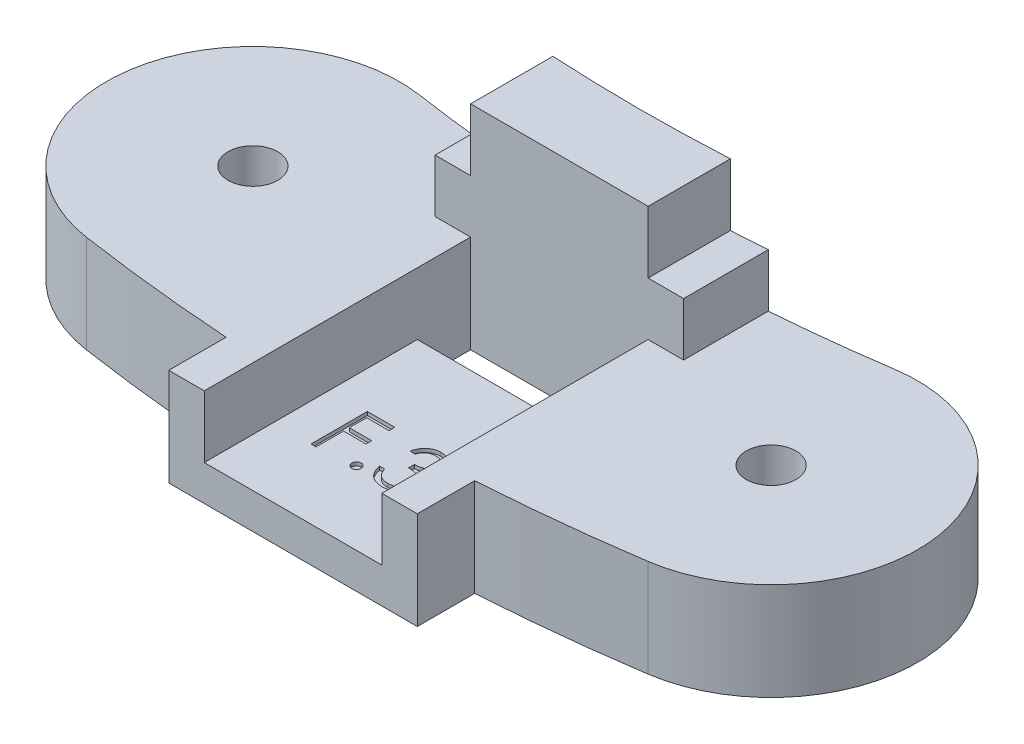
from build123d import *

# Parameters (mm, degrees)
SKETCH2_R                       = 1.4
BOSS_EXTRUDE1_DEPTH             = 14
BOSS_EXTRUDE2_REACH             = 34.049
BOSS_EXTRUDE2_END_RADIUS        = 107
SKETCH3_W                       = 14
SKETCH3_H                       = 14
BOSS_EXTRUDE2_DIRECTION_2_DEPTH = 3
SKETCH19_W                      = 15.846179349
SKETCH19_H                      = 3
CUT_EXTRUDE4_DEPTH              = 22
CUT_EXTRUDE8_DEPTH              = 34.788712692
SKETCH25_W                      = 10
SKETCH25_H                      = 3
CUT_EXTRUDE9_DEPTH              = 2
BOSS_EXTRUDE3_DEPTH             = 3
BOSS_EXTRUDE3_DEPTH_BACK        = 3.5
BOSS_EXTRUDE4_DEPTH             = 3.5
CUT_EXTRUDE10_DEPTH             = 0.2


with BuildPart() as part:
    # Sketch2 → Boss-Extrude1 (new body)
    with BuildSketch(Plane(origin=(0, 0, 0), x_dir=(1, 0, 0), z_dir=(0, 1, 0))):
        with BuildLine():
            ThreePointArc((-13.376751707, 15.494064366), (0, 14.5), (13.376751707, 15.494064366))
            ThreePointArc((13.376751707, 15.494064366), (22.755560222, 8.554111135), (15.815606991, -0.82469738))
            ThreePointArc((15.815606991, -0.82469738), (0, -2), (-15.815606991, -0.82469738))
            ThreePointArc((-15.815606991, -0.82469738), (-22.755560222, 8.554111135), (-13.376751707, 15.494064366))
        make_face()
        with Locations(Location((-14.596179349, 7.334683493, 0), (0, 0, 270))):
            Circle(SKETCH2_R, mode=Mode.SUBTRACT)
        with Locations(Location((14.596179349, 7.334683493, 0), (0, 0, 270))):
            Circle(SKETCH2_R, mode=Mode.SUBTRACT)
    extrude(amount=BOSS_EXTRUDE1_DEPTH)

    # Boss-Extrude2: up to this cylinder (the profile starts outside it)
    boss_extrude2_end = Plane(origin=(0, 7, -105), z_dir=(0, -1, 0)) * Cylinder(BOSS_EXTRUDE2_END_RADIUS, 283.098, mode=Mode.PRIVATE)
    # Sketch3 → Boss-Extrude2 (add, up to the surface)
    with BuildSketch(Plane.XY.offset(2), mode=Mode.PRIVATE) as boss_extrude2_sk1:
        with Locations((0, 7)):
            Rectangle(SKETCH3_W, SKETCH3_H)
    boss_extrude2_tool1 = extrude(boss_extrude2_sk1.sketch, amount=-BOSS_EXTRUDE2_REACH, mode=Mode.PRIVATE) - boss_extrude2_end
    add(boss_extrude2_tool1.solids().sort_by_distance((0, 7, 2))[0])
    add(boss_extrude2_tool1.solids().sort_by_distance((0, 7, 2))[1])

    # Sketch3 → Boss-Extrude2 direction 2 (add)
    with BuildSketch(Plane.XY.offset(2)):
        with Locations((0, 7)):
            Rectangle(SKETCH3_W, SKETCH3_H)
    extrude(amount=BOSS_EXTRUDE2_DIRECTION_2_DEPTH)

    # Sketch19 → Cut-Extrude4 (cut)
    with BuildSketch(Plane.XY.offset(2)):
        with Locations((-14.923089674, 7)):
            Rectangle(SKETCH19_W, SKETCH19_H)
    cut_extrude4 = extrude(amount=-CUT_EXTRUDE4_DEPTH, mode=Mode.SUBTRACT)

    # Mirror2: Cut-Extrude4 across plane
    add(cut_extrude4.mirror(Plane(origin=(0, 0, 0), x_dir=(0, 0, 1), z_dir=(1, 0, 0))), mode=Mode.SUBTRACT)

    # Sketch24 → Cut-Extrude8 (cut, through all)
    with BuildSketch(Plane.XY.offset(5)):
        Polygon((-5, 8.5), (-7, 8.5), (-7, 5.5), (-5, 5.5), (-5, 2), (5, 2), (5, 5.5), (7, 5.5), (7, 8.5), (5, 8.5), (5, 12), (-5, 12), align=None)
    extrude(amount=-CUT_EXTRUDE8_DEPTH, mode=Mode.SUBTRACT)


with BuildPart() as cut_extrude8_kept_piece:
    # of the separate pieces the step leaves, the one the design keeps (cut_extrude8_pieces_kept)
    add(part.part.solids().sort_by_distance((-15.815606991, 0, 0.82469738))[0])

    # Sketch25 → Cut-Extrude9 (cut)
    with BuildSketch(Plane(origin=(0, 2, 0), x_dir=(1, 0, 0), z_dir=(0, 1, 0))):
        with Locations((0, 8.5)):
            Rectangle(SKETCH25_W, SKETCH25_H)
    extrude(amount=-CUT_EXTRUDE9_DEPTH, mode=Mode.SUBTRACT)

    # Sketch26 → Boss-Extrude3 (add, two sides: drawn at the far end of the back side and taken through both)
    with BuildSketch(Plane(origin=(0, 5.5, 0), x_dir=(1, 0, 0), z_dir=(0, 1, 0)).offset(-BOSS_EXTRUDE3_DEPTH_BACK)):
        with BuildLine():
            Line((-7, 14.771124356), (-7, 10))
            Line((-7, 10), (-5, 10))
            Line((-5, 10), (-5, 14.638227109))
            ThreePointArc((-5, 14.638227109), (-6.00036794, 14.699138517), (-7, 14.771124356))
        make_face()
        with BuildLine():
            Line((-5, 14.638227109), (-5, 10))
            Line((-5, 10), (0, 10))
            Line((0, 10), (0, 14.5))
            ThreePointArc((0, 14.5), (-2.500955154, 14.534563377), (-5, 14.638227109))
        make_face()
        with BuildLine():
            Line((0, 14.5), (0, 10))
            Line((0, 10), (5, 10))
            Line((5, 10), (7, 10))
            Line((7, 10), (7, 14.771124356))
            ThreePointArc((7, 14.771124356), (6.00036794, 14.699138517), (5, 14.638227109))
            ThreePointArc((5, 14.638227109), (2.500955154, 14.534563377), (0, 14.5))
        make_face()
    extrude(amount=BOSS_EXTRUDE3_DEPTH + BOSS_EXTRUDE3_DEPTH_BACK)

    # Sketch27 → Boss-Extrude4 (add)
    with BuildSketch(Plane(origin=(0, 8.5, 0), x_dir=(1, 0, 0), z_dir=(0, 1, 0))):
        with BuildLine():
            Line((-5, 14.638227109), (-5, 10))
            Line((-5, 10), (5, 10))
            Line((5, 10), (5, 14.638227109))
            ThreePointArc((5, 14.638227109), (0, 14.5), (-5, 14.638227109))
        make_face()
    extrude(amount=BOSS_EXTRUDE4_DEPTH)

    # Sketch28 → Cut-Extrude10 (cut)
    with BuildSketch(Plane(origin=(0, 2, 0), x_dir=(1, 0, 0), z_dir=(0, 1, 0))):
        Polygon((-2.898336932, 2.085555905), (-1.351542061, 2.085555905), (-1.351542061, 1.759914879), (-2.613401035, 1.759914879), (-2.613401035, 0.782991802), (-1.351542061, 0.782991802), (-1.351542061, 0.457350776), (-2.613401035, 0.457350776), (-2.613401035, -1.089444095), (-2.898336932, -1.089444095), align=None)
        with BuildLine():
            add(Edge.make_bspline(
                [(-0.557792061, -0.600982557), (-0.540111654, -0.60203318), (-0.505451283, -0.604092802), (-0.455341503, -0.618223071), (-0.409989204, -0.643313427), (-0.369592097, -0.676753233), (-0.336294079, -0.717298585), (-0.310309559, -0.762289159), (-0.29630238, -0.812818461), (-0.29425776, -0.847679666), (-0.293208727, -0.86556589)],
                knots=[0, 0, 0, 0, 1.020151414, 1.999887582, 2.974338812, 3.990962822, 5.007586832, 5.987933904, 6.967670073, 8, 8, 8, 8], degree=3))
            add(Edge.make_bspline(
                [(-0.293208727, -0.86556589), (-0.294293308, -0.883022339), (-0.296432085, -0.917446201), (-0.310277451, -0.967594385), (-0.336492111, -1.012613077), (-0.369362426, -1.053708588), (-0.409999191, -1.087219234), (-0.455448723, -1.112096126), (-0.50533365, -1.127238136), (-0.540092029, -1.129166991), (-0.557792061, -1.130149224)],
                knots=[0, 0, 0, 0, 1.009421747, 1.99056486, 2.972319754, 3.999869655, 5.017953583, 5.993804169, 6.978383603, 8, 8, 8, 8], degree=3))
            add(Edge.make_bspline(
                [(-0.557792061, -1.130149224), (-0.575504847, -1.129202532), (-0.610084844, -1.127354342), (-0.659783568, -1.111785224), (-0.705509889, -1.087452514), (-0.746138742, -1.053646103), (-0.779284355, -1.012824545), (-0.804344524, -0.967284344), (-0.819394159, -0.917589754), (-0.82137343, -0.883050614), (-0.822375394, -0.86556589)],
                knots=[0, 0, 0, 0, 1.022052826, 1.995314843, 2.982371812, 4.00089066, 5.028879526, 6.005146991, 6.990147033, 8, 8, 8, 8], degree=3))
            add(Edge.make_bspline(
                [(-0.822375394, -0.86556589), (-0.821411918, -0.847650382), (-0.81953085, -0.81267255), (-0.80431293, -0.762599073), (-0.779478795, -0.717089132), (-0.745909615, -0.676815092), (-0.705519718, -0.643080896), (-0.659893875, -0.618529262), (-0.609965149, -0.603978316), (-0.575484705, -0.601998462), (-0.557792061, -0.600982557)],
                knots=[0, 0, 0, 0, 1.032775665, 2.016367738, 2.991239715, 4.008302682, 5.025365648, 6.011011707, 6.979408107, 8, 8, 8, 8], degree=3))
        make_face()
        with BuildLine():
            Line((0.520893837, 1.352863597), (0.235957939, 1.352863597))
            add(Edge.make_bspline(
                [(0.235957939, 1.352863597), (0.243677317, 1.384824493), (0.25876807, 1.447305431), (0.290243726, 1.536574875), (0.324533051, 1.621051212), (0.365707453, 1.69915265), (0.410618965, 1.772448798), (0.462074577, 1.839277218), (0.517700325, 1.901337551), (0.579227244, 1.956413131), (0.643751101, 2.006285785), (0.712181077, 2.048808158), (0.783140417, 2.085387926), (0.857120759, 2.115523422), (0.934342357, 2.138225147), (1.014107087, 2.154695963), (1.096623976, 2.165392188), (1.152637862, 2.166436095), (1.181080135, 2.166966161)],
                knots=[0, 0, 0, 0, 1.162005537, 2.271625781, 3.343758855, 4.383309926, 5.390229558, 6.379919256, 7.361854164, 8.333198761, 9.295911338, 10.242430842, 11.177959212, 12.116337295, 13.062827104, 14.020064771, 14.994644689, 16, 16, 16, 16], degree=3))
            add(Edge.make_bspline(
                [(1.181080135, 2.166966161), (1.222520908, 2.165715002), (1.304498511, 2.163239976), (1.424933561, 2.140639023), (1.541072175, 2.104874796), (1.651643136, 2.055459343), (1.754348428, 1.994510852), (1.84573054, 1.921971412), (1.924550832, 1.839240617), (1.990676446, 1.747861791), (2.042451624, 1.650202864), (2.080629977, 1.549691293), (2.103872502, 1.446565505), (2.106884721, 1.376935688), (2.108393837, 1.342051297)],
                knots=[0, 0, 0, 0, 1.083050992, 2.142477498, 3.193116406, 4.255571735, 5.30263384, 6.308962982, 7.297363603, 8.282367274, 9.249857812, 10.179914175, 11.08814088, 12, 12, 12, 12], degree=3))
            add(Edge.make_bspline(
                [(2.108393837, 1.342051297), (2.107338293, 1.308480848), (2.105272759, 1.242788688), (2.087734326, 1.146884187), (2.058219288, 1.056495021), (2.017334574, 0.971240681), (1.964410454, 0.891661719), (1.900300222, 0.817579089), (1.824551379, 0.74866421), (1.767148342, 0.709185831), (1.73759556, 0.688861193)],
                knots=[0, 0, 0, 0, 1.024540389, 2.004866551, 2.965041327, 3.920577974, 4.882998113, 5.874504559, 6.905732034, 8, 8, 8, 8], degree=3))
            add(Edge.make_bspline(
                [(1.73759556, 0.688861193), (1.77137008, 0.672552423), (1.838287173, 0.640240033), (1.929500867, 0.576870882), (2.01230294, 0.503704052), (2.058479885, 0.446606074), (2.081681096, 0.417917684)],
                knots=[0, 0, 0, 0, 1.015518401, 2.012035669, 3.001164323, 4, 4, 4, 4], degree=3))
            add(Edge.make_bspline(
                [(2.081681096, 0.417917684), (2.0969586, 0.397001009), (2.127263427, 0.355510185), (2.164669947, 0.288802141), (2.198605358, 0.221354719), (2.225048771, 0.151360115), (2.245526493, 0.079629595), (2.260164179, 0.006039993), (2.269257507, -0.069468785), (2.270559758, -0.120552249), (2.27121435, -0.146229953)],
                knots=[0, 0, 0, 0, 1.025084078, 2.033381695, 3.024893161, 4.013698104, 4.991890475, 5.976764909, 6.982997093, 8, 8, 8, 8], degree=3))
            add(Edge.make_bspline(
                [(2.27121435, -0.146229953), (2.269586469, -0.190688771), (2.26633837, -0.279397184), (2.237306103, -0.410456396), (2.192299806, -0.538568102), (2.1283853, -0.661100277), (2.050491202, -0.775745337), (1.957819915, -0.878321703), (1.851424388, -0.966494723), (1.732764978, -1.040164001), (1.604207297, -1.099053831), (1.466706581, -1.139927368), (1.322244032, -1.166548382), (1.223177412, -1.169403042), (1.172811906, -1.170854352)],
                knots=[0, 0, 0, 0, 0.955779014, 1.907060117, 2.875433937, 3.871313158, 4.872415639, 5.851225146, 6.836215519, 7.83643374, 8.849228613, 9.86973379, 10.916971861, 12, 12, 12, 12], degree=3))
            add(Edge.make_bspline(
                [(1.172811906, -1.170854352), (1.138867255, -1.170066758), (1.072075501, -1.168517037), (0.973883184, -1.157922877), (0.880155643, -1.138573515), (0.790766151, -1.112535517), (0.705635296, -1.079523008), (0.625022858, -1.038412475), (0.548432883, -0.990051327), (0.47658812, -0.933868715), (0.409497134, -0.871020642), (0.348942877, -0.800391398), (0.293915779, -0.72328661), (0.245889242, -0.638810694), (0.202675721, -0.548055354), (0.167132996, -0.449858502), (0.135849659, -0.345097996), (0.121305016, -0.272093189), (0.113842555, -0.234636403)],
                knots=[0, 0, 0, 0, 1.048658725, 2.063410685, 3.046034179, 4.001477787, 4.936774919, 5.862367409, 6.792675028, 7.730719943, 8.675894397, 9.627829632, 10.600096036, 11.597688215, 12.626045268, 13.701542398, 14.82072376, 16, 16, 16, 16], degree=3))
            Line((0.113842555, -0.234636403), (0.398778452, -0.234636403))
            add(Edge.make_bspline(
                [(0.398778452, -0.234636403), (0.406201867, -0.259083008), (0.420641052, -0.306633778), (0.445219451, -0.375068912), (0.473221384, -0.437805146), (0.503261019, -0.495302693), (0.534810038, -0.548127801), (0.570111434, -0.594883639), (0.606550587, -0.637623858), (0.634018287, -0.661703613), (0.647461345, -0.673488566)],
                knots=[0, 0, 0, 0, 1.198163088, 2.33053128, 3.407730985, 4.417276592, 5.372219308, 6.28897303, 7.162600585, 8, 8, 8, 8], degree=3))
            add(Edge.make_bspline(
                [(0.647461345, -0.673488566), (0.665238239, -0.687193984), (0.700737155, -0.714562512), (0.75858405, -0.74948899), (0.819421483, -0.779752206), (0.884567651, -0.802869558), (0.952616764, -0.822443579), (1.024668732, -0.835252907), (1.100087878, -0.844041463), (1.15158435, -0.844817008), (1.177900047, -0.845213326)],
                knots=[0, 0, 0, 0, 0.946170439, 1.889420265, 2.845303464, 3.807233317, 4.801018734, 5.828864929, 6.890507805, 8, 8, 8, 8], degree=3))
            add(Edge.make_bspline(
                [(1.177900047, -0.845213326), (1.207612153, -0.844654612), (1.265711611, -0.843562095), (1.350488519, -0.833514847), (1.431140275, -0.818882257), (1.506771429, -0.796282623), (1.578372675, -0.768359993), (1.644940314, -0.733300368), (1.707348211, -0.692166228), (1.764797029, -0.645412848), (1.816454739, -0.594230492), (1.86193844, -0.540697206), (1.900605097, -0.485038704), (1.931795915, -0.42694698), (1.956425343, -0.366662594), (1.973192246, -0.30401637), (1.984850406, -0.239520993), (1.985799833, -0.195679714), (1.986278452, -0.173578711)],
                knots=[0, 0, 0, 0, 1.217147791, 2.380027433, 3.494444702, 4.572153297, 5.609568379, 6.639424714, 7.649109417, 8.668170816, 9.669597737, 10.625200337, 11.543417969, 12.441394052, 13.322311151, 14.205496177, 15.095365482, 16, 16, 16, 16], degree=3))
            add(Edge.make_bspline(
                [(1.986278452, -0.173578711), (1.98489025, -0.143995568), (1.982120753, -0.084976483), (1.960976542, 0.001853031), (1.926197715, 0.085512841), (1.87750908, 0.164575593), (1.81824024, 0.237850875), (1.748966361, 0.303230006), (1.669112182, 0.357177874), (1.595615587, 0.394451155), (1.530514337, 0.419884788), (1.47480181, 0.436825648), (1.412429748, 0.451170893), (1.344152418, 0.464517025), (1.269455357, 0.475875677), (1.188419888, 0.485347895), (1.10102959, 0.492927111), (1.040531176, 0.496311747), (1.009355375, 0.498055905)],
                knots=[0, 0, 0, 0, 1.07054697, 2.135767047, 3.216561865, 4.33974944, 5.486079747, 6.621378074, 7.775625952, 8.963672916, 9.598146892, 10.304877434, 11.070270905, 11.915000392, 12.823868403, 13.805723172, 14.86925407, 16, 16, 16, 16], degree=3))
            Line((1.009355375, 0.498055905), (1.009355375, 0.82369693))
            add(Edge.make_bspline(
                [(1.009355375, 0.82369693), (1.048635718, 0.824363502), (1.125576261, 0.825669153), (1.237966095, 0.841460705), (1.345438314, 0.863305275), (1.445611144, 0.896765414), (1.536913905, 0.935627683), (1.616125259, 0.980850759), (1.682135457, 1.031119853), (1.734623714, 1.087210863), (1.774110943, 1.147368084), (1.802982395, 1.210066767), (1.820036977, 1.27585645), (1.822313603, 1.320755185), (1.823457939, 1.343323333)],
                knots=[0, 0, 0, 0, 1.321986639, 2.589447074, 3.816329219, 5.01088745, 6.139805852, 7.153945165, 8.075214402, 8.924034688, 9.728124013, 10.488707548, 11.240355623, 12, 12, 12, 12], degree=3))
            add(Edge.make_bspline(
                [(1.823457939, 1.343323333), (1.823082009, 1.359903859), (1.822334115, 1.392890029), (1.812902298, 1.441082055), (1.798729061, 1.48780077), (1.779243878, 1.532847498), (1.753163341, 1.575909818), (1.721952196, 1.617354861), (1.684788276, 1.656946003), (1.642202049, 1.693848865), (1.596471341, 1.729018101), (1.546351902, 1.758875472), (1.493354915, 1.784407064), (1.437421707, 1.805461398), (1.378370762, 1.821299467), (1.316479527, 1.832671266), (1.251629986, 1.839781138), (1.207387057, 1.840804773), (1.184896241, 1.841325135)],
                knots=[0, 0, 0, 0, 0.884392785, 1.759457502, 2.611959086, 3.489218968, 4.37281399, 5.2945488, 6.255912374, 7.266815255, 8.301784654, 9.332968512, 10.37626691, 11.440494194, 12.520033166, 13.637162961, 14.798855837, 16, 16, 16, 16], degree=3))
            add(Edge.make_bspline(
                [(1.184896241, 1.841325135), (1.148745085, 1.840062971), (1.078133469, 1.837597671), (0.976338509, 1.816004938), (0.88170597, 1.78155339), (0.809371608, 1.740429866), (0.755956701, 1.699834829), (0.717786908, 1.664381522), (0.680303302, 1.624981746), (0.645971866, 1.579208791), (0.611251902, 1.530162489), (0.579642907, 1.475349578), (0.548927329, 1.416199877), (0.530419301, 1.374384551), (0.520893837, 1.352863597)],
                knots=[0, 0, 0, 0, 1.472543308, 2.876219568, 4.221790263, 5.565193594, 6.249813518, 6.953379497, 7.687249741, 8.463570142, 9.283606569, 10.136032583, 11.040678096, 12, 12, 12, 12], degree=3))
        make_face()
    extrude(amount=-CUT_EXTRUDE10_DEPTH, mode=Mode.SUBTRACT)


solid = cut_extrude8_kept_piece.part
